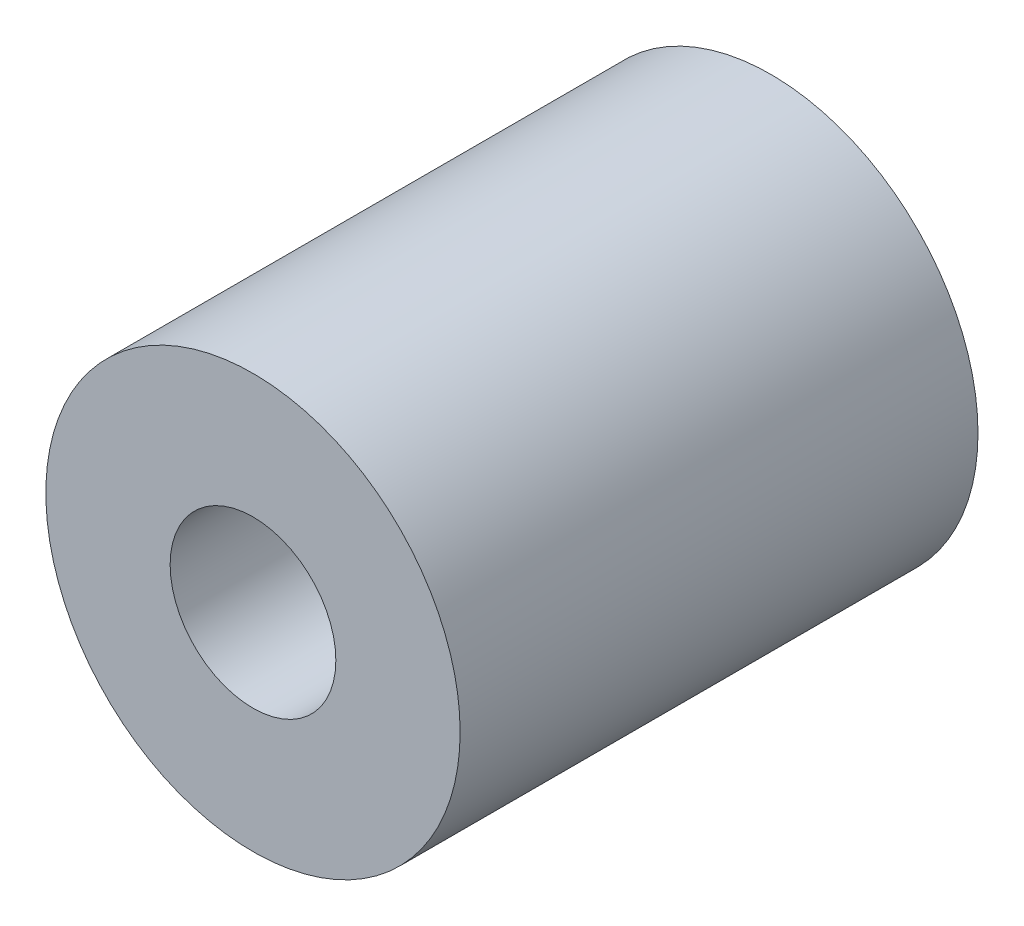
from build123d import *

# Parameters (mm, degrees)
SKETCH1_R           = 4
SKETCH1_R_2         = 1.6
BOSS_EXTRUDE1_DEPTH = 10


with BuildPart() as part:
    # Sketch1 → Boss-Extrude1 (new body)
    with BuildSketch(Plane.XY):
        Circle(SKETCH1_R)
        Circle(SKETCH1_R_2, mode=Mode.SUBTRACT)
    extrude(amount=BOSS_EXTRUDE1_DEPTH)


solid = part.part
